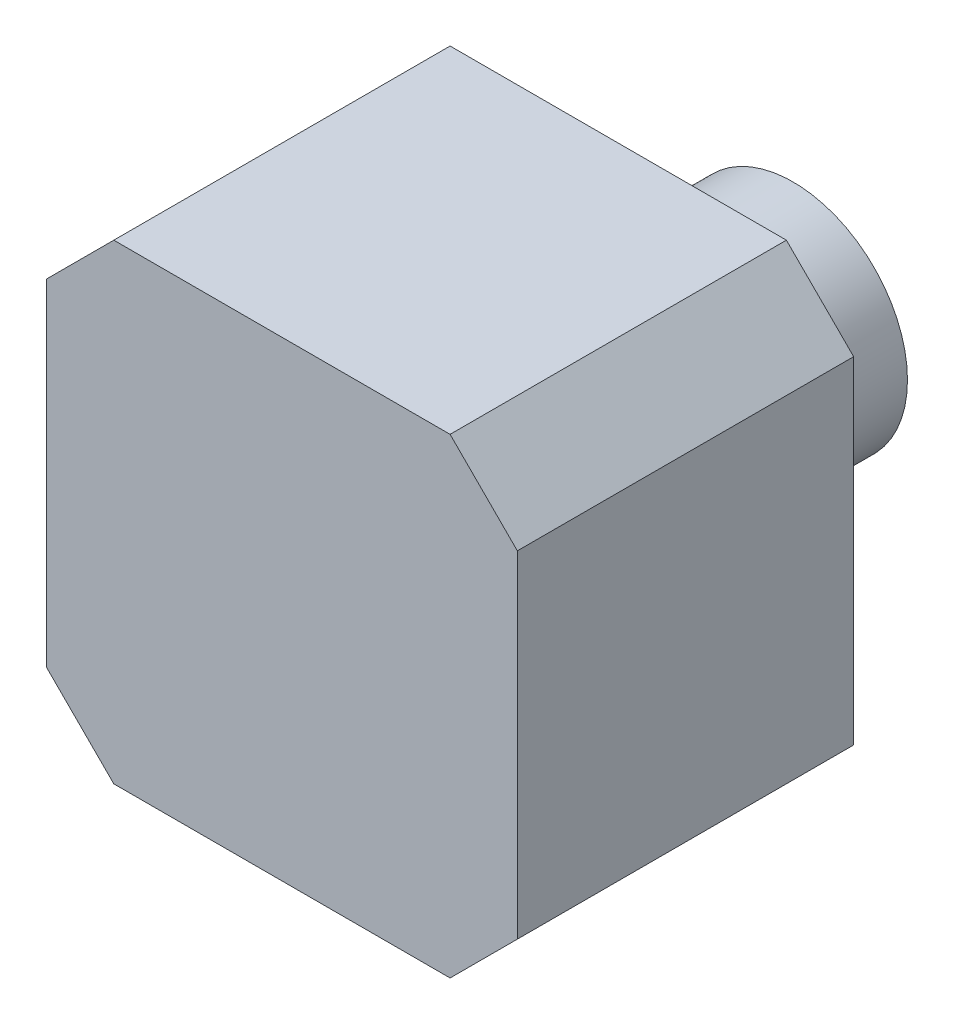
from build123d import *

# Parameters (mm, degrees)
SKETCH_1_W      = 35
SKETCH_1_H      = 35
EXTRUDE_1_DEPTH = 25
CHAMFER_1_SIZE  = 5
SKETCH_2_R      = 11
EXTRUDE_2_DEPTH = 2
SKETCH_3_R      = 8.5
EXTRUDE_3_DEPTH = 11


with BuildPart() as part:
    # Эскиз1 → Бобышка-Вытянуть1 (new body)
    with BuildSketch(Plane.XY):
        Rectangle(SKETCH_1_W, SKETCH_1_H)
    extrude(amount=EXTRUDE_1_DEPTH)

    # Фаска1
    chamfer_1_edges = [part.edges().sort_by_distance(p)[0] for p in [
        (17.5, -17.5, 12.5),
        (-17.5, -17.5, 12.5),
        (-17.5, 17.5, 12.5),
        (17.5, 17.5, 12.5),
    ]]
    chamfer(chamfer_1_edges, length=CHAMFER_1_SIZE)

    # Эскиз2 → Бобышка-Вытянуть2 (add)
    with BuildSketch(Plane(origin=(0, 0, 0), x_dir=(-1, 0, 0), z_dir=(0, 0, -1))):
        Circle(SKETCH_2_R)
    extrude(amount=EXTRUDE_2_DEPTH)

    # Эскиз3 → Бобышка-Вытянуть3 (add)
    with BuildSketch(Plane(origin=(0, 0, -2), x_dir=(-1, 0, 0), z_dir=(0, 0, -1))):
        Circle(SKETCH_3_R)
    extrude(amount=EXTRUDE_3_DEPTH)


solid = part.part
